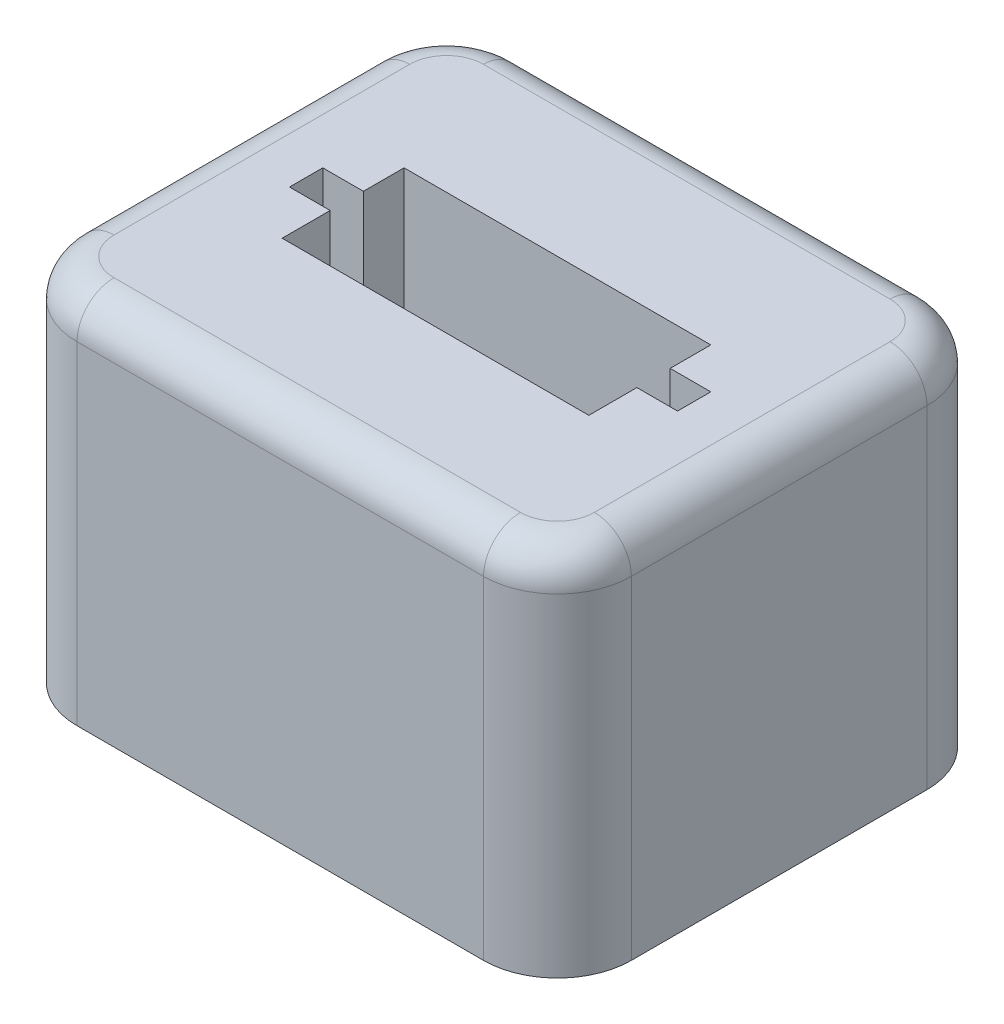
from build123d import *

# Parameters (mm, degrees)
EXTRUDE_388_DEPTH      = 20
FILLET_1_R             = 2
SKETCH_6_R             = 1
CUT_EXTRUDE_1034_DEPTH = 7
CUT_EXTRUDE_1428_REACH = 45.313
SKETCH_3_W             = 16.6
SKETCH_3_H             = 3
SKETCH_2_W             = 21
SKETCH_2_H             = 1.8
CUT_EXTRUDE_1921_DEPTH = 12
SKETCH_7_W             = 16.6
SKETCH_7_H             = 2.2
CUT_EXTRUDE_1_DEPTH    = 12


with BuildPart() as part:
    # Эскиз1 → Extrude 388 (new body)
    with BuildSketch(Plane(origin=(0, 0, 0), x_dir=(1, 0, 0), z_dir=(0, 1, 0))):
        with BuildLine():
            Line((4, 0), (26, 0))
            ThreePointArc((26, 0), (28.828427125, 1.171572875), (30, 4))
            Line((30, 4), (30, 20))
            ThreePointArc((30, 20), (28.828427125, 22.828427125), (26, 24))
            Line((26, 24), (4, 24))
            ThreePointArc((4, 24), (1.171572875, 22.828427125), (0, 20))
            Line((0, 20), (0, 4))
            ThreePointArc((0, 4), (1.171572875, 1.171572875), (4, 0))
        make_face()
    extrude(amount=EXTRUDE_388_DEPTH)

    # Скругление1
    fillet_1_edges = [part.edges().sort_by_distance(p)[0] for p in [
        (1.171572875, 20, -22.828427125),
        (0, 20, -12),
        (1.171572875, 20, -1.171572875),
        (15, 20, 0),
        (28.828427125, 20, -1.171572875),
        (30, 20, -12),
        (28.828427125, 20, -22.828427125),
        (15, 20, -24),
    ]]
    fillet(fillet_1_edges, radius=FILLET_1_R)

    # Эскиз6 → Cut-Extrude 1034 (cut)
    with BuildSketch(Plane.XZ):
        with Locations(Location((4, -4, 0), (0, 0, 270))):
            Circle(SKETCH_6_R)
        with Locations(Location((26, -4, 0), (0, 0, 270))):
            Circle(SKETCH_6_R)
        with Locations(Location((26, -20, 0), (0, 0, 270))):
            Circle(SKETCH_6_R)
        with Locations(Location((4, -20, 0), (0, 0, 270))):
            Circle(SKETCH_6_R)
    extrude(amount=-CUT_EXTRUDE_1034_DEPTH, mode=Mode.SUBTRACT)

    # Эскиз3 → Cut-Extrude 1428 (cut, up to next)
    with BuildSketch(Plane(origin=(0, 20, 0), x_dir=(1, 0, 0), z_dir=(0, 1, 0)), mode=Mode.PRIVATE) as cut_extrude_1428_sk1:
        with Locations((15, 9.9)):
            Rectangle(SKETCH_3_W, SKETCH_3_H)
    cut_extrude_1428_tool1 = extrude(cut_extrude_1428_sk1.sketch, amount=-CUT_EXTRUDE_1428_REACH, mode=Mode.PRIVATE) & part.part
    add(cut_extrude_1428_tool1.solids().sort_by_distance((15, 20, -9.9))[0], mode=Mode.SUBTRACT)

    # Эскиз2 → Cut-Extrude 1921 (cut)
    with BuildSketch(Plane(origin=(0, 20, 0), x_dir=(1, 0, 0), z_dir=(0, 1, 0))):
        with Locations((15, 11.9)):
            Rectangle(SKETCH_2_W, SKETCH_2_H)
    extrude(amount=-CUT_EXTRUDE_1921_DEPTH, mode=Mode.SUBTRACT)

    # Эскиз7 → Вырез-Вытянуть1 (cut)
    with BuildSketch(Plane(origin=(0, 20, 0), x_dir=(1, 0, 0), z_dir=(0, 1, 0))):
        with Locations((15, 13.9)):
            Rectangle(SKETCH_7_W, SKETCH_7_H)
    extrude(amount=-CUT_EXTRUDE_1_DEPTH, mode=Mode.SUBTRACT)


solid = part.part
